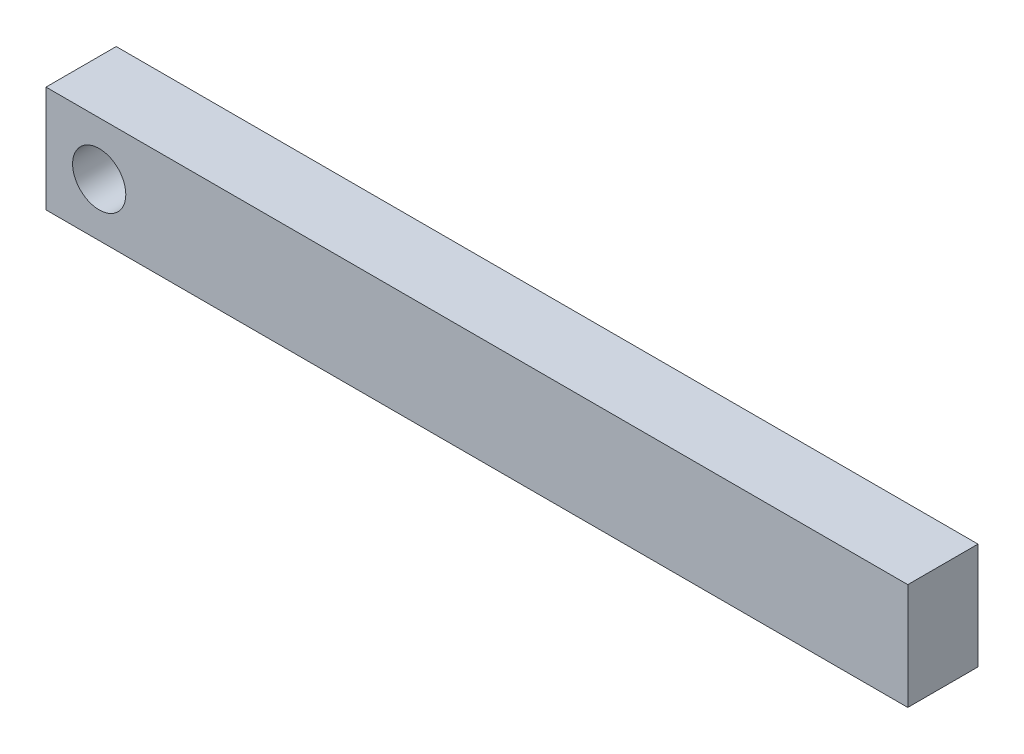
from build123d import *

# Parameters (mm, degrees)
SKETCH1_W           = 40.5
SKETCH1_H           = 5
SKETCH1_R           = 1.25
BOSS_EXTRUDE1_DEPTH = 3.3


with BuildPart() as part:
    # Sketch1 → Boss-Extrude1 (new body)
    with BuildSketch(Plane.XY):
        with Locations((17.75, 0)):
            Rectangle(SKETCH1_W, SKETCH1_H)
        Circle(SKETCH1_R, mode=Mode.SUBTRACT)
    extrude(amount=BOSS_EXTRUDE1_DEPTH)


solid = part.part
